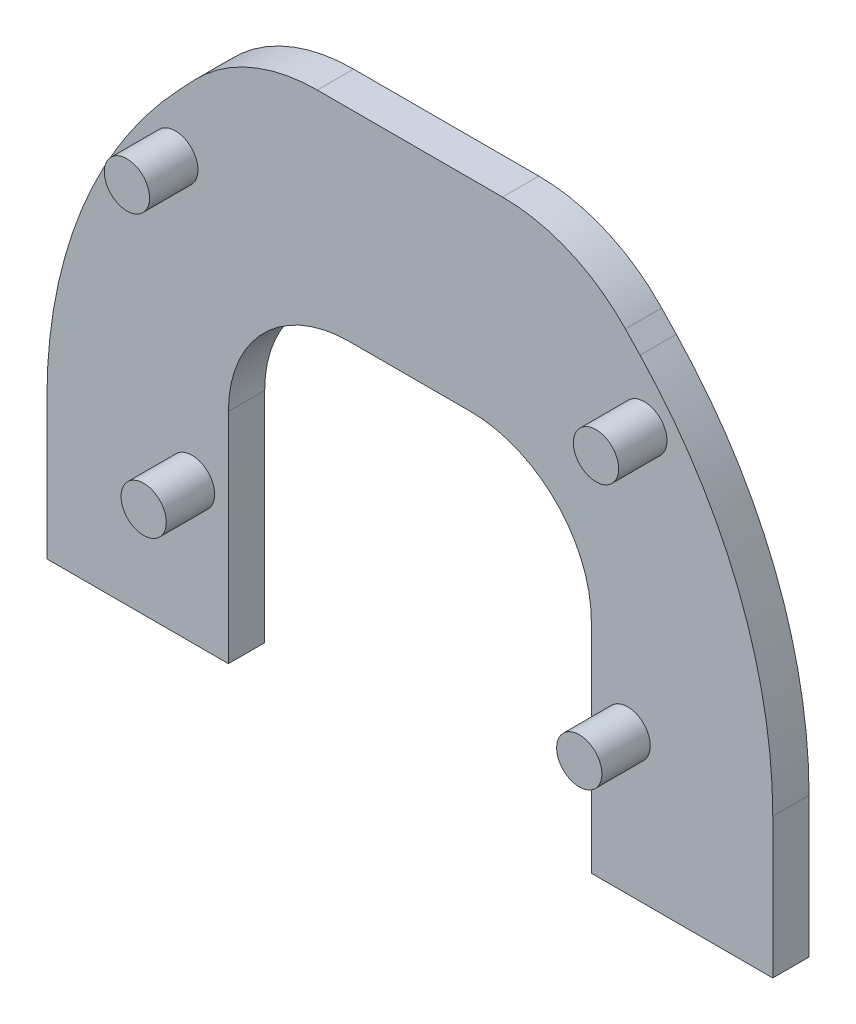
from build123d import *

# Parameters (mm, degrees)
BOSS_EXTRUDE1_DEPTH = 3.81
SKETCH3_R           = 2.3749
BOSS_EXTRUDE2_DEPTH = 8.89


with BuildPart() as part:
    # Sketch1 → Boss-Extrude1 (new body)
    with BuildSketch(Plane(origin=(0, 0, 0), x_dir=(-1, 0, 0), z_dir=(0, 0, 1))):
        with BuildLine():
            Line((22.628547269, -66.432139719), (24.16561852, -64.81086345))
            ThreePointArc((24.16561852, -64.81086345), (34.487993287, -48.673067402), (38.1, -29.859952573))
            Line((38.1, -29.859952573), (38.1, -15.158740079))
            Line((38.1, -15.158740079), (19.05, -15.158740079))
            Line((19.05, -15.158740079), (19.05, -38.1))
            ThreePointArc((19.05, -38.1), (15.330256121, -47.080256121), (6.35, -50.8))
            Line((6.35, -50.8), (-6.35, -50.8))
            ThreePointArc((-6.35, -50.8), (-15.330256121, -47.080256121), (-19.05, -38.1))
            Line((-19.05, -38.1), (-19.05, -15.158740079))
            Line((-19.05, -15.158740079), (-38.1, -15.158740079))
            Line((-38.1, -15.158740079), (-38.1, -29.859952521))
            ThreePointArc((-38.1, -29.859952521), (-34.48799327, -48.673067394), (-24.165618457, -64.810863465))
            Line((-24.165618457, -64.810863465), (-22.628547192, -66.432139742))
            ThreePointArc((-22.628547192, -66.432139742), (-16.748004858, -70.533761809), (-9.725580732, -71.979320912))
            Line((-9.725580732, -71.979320912), (9.725580787, -71.979320912))
            ThreePointArc((9.725580787, -71.979320912), (16.748004927, -70.533761802), (22.628547269, -66.432139719))
        make_face()
    extrude(amount=BOSS_EXTRUDE1_DEPTH)

    # Sketch3 → Boss-Extrude2 (add)
    with BuildSketch(Plane.XY):
        with Locations((-24.622521445, 58.445286133)):
            Circle(SKETCH3_R)
        with Locations((-22.865421031, 29.826745675)):
            Circle(SKETCH3_R)
    boss_extrude2 = extrude(amount=BOSS_EXTRUDE2_DEPTH)

    # Mirror1: Boss-Extrude2 across plane
    add(boss_extrude2.mirror(Plane(origin=(0, 0, 0), x_dir=(0, 0, 1), z_dir=(1, 0, 0))))


solid = part.part
